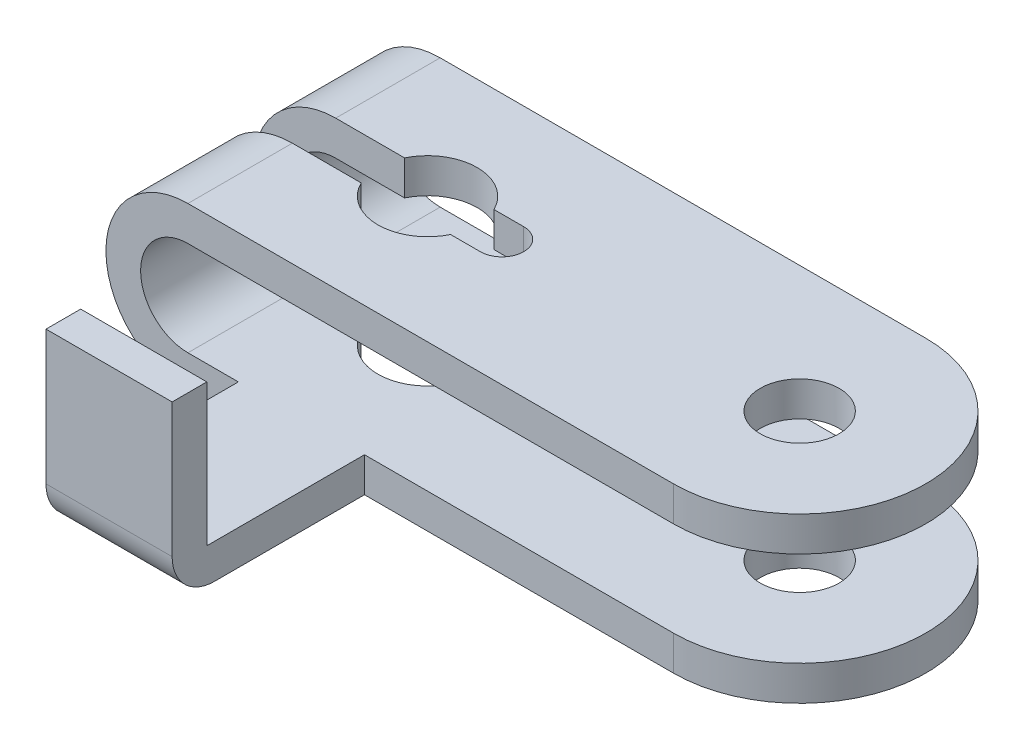
from build123d import *

# Parameters (mm, degrees)
SALIENTE_EXTRUIR1_DEPTH = 16
CORTAR_EXTRUIR1_REACH   = 45.239
CROQUIS2_W              = 5.2
CROQUIS2_H              = 2.75
CROQUIS2_R              = 2.5
CROQUIS5_W              = 4
CROQUIS5_H              = 2.2
SALIENTE_EXTRUIR4_DEPTH = 12.2
CROQUIS6_W              = 8
CROQUIS6_H              = 2.2
SALIENTE_EXTRUIR5_DEPTH = 9
REDONDEO2_R             = 2.7


with BuildPart() as part:
    # Croquis1 → Saliente-Extruir1 (new body)
    with BuildSketch(Plane.XY):
        with BuildLine():
            Line((0, -8.2), (38.8, -8.2))
            Line((38.8, -8.2), (38.8, -10.4))
            Line((38.8, -10.4), (0, -10.4))
            ThreePointArc((0, -10.4), (-5.2, -5.2), (0, 0))
            Line((0, 0), (38.8, 0))
            Line((38.8, 0), (38.8, -2.2))
            Line((38.8, -2.2), (0, -2.2))
            ThreePointArc((0, -2.2), (-3, -5.2), (0, -8.2))
        make_face()
    extrude(amount=SALIENTE_EXTRUIR1_DEPTH)

    # Cortar-Extruir1: up to this face of the body (flat: up to its plane)
    cortar_extruir1_end = Plane(part.part.faces().sort_by_distance((19.4, -10.4, 8))[0])
    # Croquis2 → Cortar-Extruir1 (cut, up to the picked face)
    with BuildSketch(Plane(origin=(0, 0, 0), x_dir=(1, 0, 0), z_dir=(0, 1, 0)), mode=Mode.PRIVATE) as cortar_extruir1_sk1:
        with Locations((-2.6, -8)):
            Rectangle(CROQUIS2_W, CROQUIS2_H)
    cortar_extruir1_tool1 = split(extrude(cortar_extruir1_sk1.sketch, amount=-CORTAR_EXTRUIR1_REACH, mode=Mode.PRIVATE), bisect_by=cortar_extruir1_end, keep=Keep.BOTH, mode=Mode.PRIVATE)
    # Croquis2 → Cortar-Extruir1 (cut, up to the picked face)
    with BuildSketch(Plane(origin=(0, 0, 0), x_dir=(1, 0, 0), z_dir=(0, 1, 0)), mode=Mode.PRIVATE) as cortar_extruir1_sk2:
        with BuildLine():
            Line((4.36594372, -6.625), (0, -6.625))
            Line((0, -6.625), (0, -9.375))
            Line((0, -9.375), (4.36594372, -9.375))
            ThreePointArc((4.36594372, -9.375), (4.05, -8), (4.36594372, -6.625))
        make_face()
    cortar_extruir1_tool2 = split(extrude(cortar_extruir1_sk2.sketch, amount=-CORTAR_EXTRUIR1_REACH, mode=Mode.PRIVATE), bisect_by=cortar_extruir1_end, keep=Keep.BOTH, mode=Mode.PRIVATE)
    # Croquis2 → Cortar-Extruir1 (cut, up to the picked face)
    with BuildSketch(Plane(origin=(0, 0, 0), x_dir=(1, 0, 0), z_dir=(0, 1, 0)), mode=Mode.PRIVATE) as cortar_extruir1_sk3:
        with BuildLine():
            ThreePointArc((10.03405628, -6.625), (7.2, -4.85), (4.36594372, -6.625))
            Line((4.36594372, -6.625), (10.03405628, -6.625))
        make_face()
    cortar_extruir1_tool3 = split(extrude(cortar_extruir1_sk3.sketch, amount=-CORTAR_EXTRUIR1_REACH, mode=Mode.PRIVATE), bisect_by=cortar_extruir1_end, keep=Keep.BOTH, mode=Mode.PRIVATE)
    # Croquis2 → Cortar-Extruir1 (cut, up to the picked face)
    with BuildSketch(Plane(origin=(0, 0, 0), x_dir=(1, 0, 0), z_dir=(0, 1, 0)), mode=Mode.PRIVATE) as cortar_extruir1_sk4:
        with BuildLine():
            Line((10.03405628, -6.625), (4.36594372, -6.625))
            ThreePointArc((4.36594372, -6.625), (4.05, -8), (4.36594372, -9.375))
            Line((4.36594372, -9.375), (10.03405628, -9.375))
            ThreePointArc((10.03405628, -9.375), (10.26999815, -8.705415735), (10.35, -8))
            ThreePointArc((10.35, -8), (10.26999815, -7.294584265), (10.03405628, -6.625))
        make_face()
    cortar_extruir1_tool4 = split(extrude(cortar_extruir1_sk4.sketch, amount=-CORTAR_EXTRUIR1_REACH, mode=Mode.PRIVATE), bisect_by=cortar_extruir1_end, keep=Keep.BOTH, mode=Mode.PRIVATE)
    # Croquis2 → Cortar-Extruir1 (cut, up to the picked face)
    with BuildSketch(Plane(origin=(0, 0, 0), x_dir=(1, 0, 0), z_dir=(0, 1, 0)), mode=Mode.PRIVATE) as cortar_extruir1_sk5:
        with BuildLine():
            Line((10.03405628, -9.375), (4.36594372, -9.375))
            ThreePointArc((4.36594372, -9.375), (7.2, -11.15), (10.03405628, -9.375))
        make_face()
    cortar_extruir1_tool5 = split(extrude(cortar_extruir1_sk5.sketch, amount=-CORTAR_EXTRUIR1_REACH, mode=Mode.PRIVATE), bisect_by=cortar_extruir1_end, keep=Keep.BOTH, mode=Mode.PRIVATE)
    # Croquis2 → Cortar-Extruir1 (cut, up to the picked face)
    with BuildSketch(Plane(origin=(0, 0, 0), x_dir=(1, 0, 0), z_dir=(0, 1, 0)), mode=Mode.PRIVATE) as cortar_extruir1_sk6:
        with BuildLine():
            Line((11.925, -6.625), (10.03405628, -6.625))
            ThreePointArc((10.03405628, -6.625), (10.26999815, -7.294584265), (10.35, -8))
            ThreePointArc((10.35, -8), (10.26999815, -8.705415735), (10.03405628, -9.375))
            Line((10.03405628, -9.375), (11.925, -9.375))
            ThreePointArc((11.925, -9.375), (13.3, -8), (11.925, -6.625))
        make_face()
    cortar_extruir1_tool6 = split(extrude(cortar_extruir1_sk6.sketch, amount=-CORTAR_EXTRUIR1_REACH, mode=Mode.PRIVATE), bisect_by=cortar_extruir1_end, keep=Keep.BOTH, mode=Mode.PRIVATE)
    # Croquis2 → Cortar-Extruir1 (cut, up to the picked face)
    with BuildSketch(Plane(origin=(0, 0, 0), x_dir=(1, 0, 0), z_dir=(0, 1, 0)), mode=Mode.PRIVATE) as cortar_extruir1_sk7:
        with Locations(Location((30.8, -8, 0), (0, 0, 180))):
            Circle(CROQUIS2_R)
    cortar_extruir1_tool7 = split(extrude(cortar_extruir1_sk7.sketch, amount=-CORTAR_EXTRUIR1_REACH, mode=Mode.PRIVATE), bisect_by=cortar_extruir1_end, keep=Keep.BOTH, mode=Mode.PRIVATE)
    # Croquis2 → Cortar-Extruir1 (cut, up to the picked face)
    with BuildSketch(Plane(origin=(0, 0, 0), x_dir=(1, 0, 0), z_dir=(0, 1, 0)), mode=Mode.PRIVATE) as cortar_extruir1_sk8:
        with BuildLine():
            Line((38.8, 0), (30.8, 0))
            ThreePointArc((30.8, 0), (36.456854249, -2.343145751), (38.8, -8))
            Line((38.8, -8), (38.8, 0))
        make_face()
    cortar_extruir1_tool8 = split(extrude(cortar_extruir1_sk8.sketch, amount=-CORTAR_EXTRUIR1_REACH, mode=Mode.PRIVATE), bisect_by=cortar_extruir1_end, keep=Keep.BOTH, mode=Mode.PRIVATE)
    # Croquis2 → Cortar-Extruir1 (cut, up to the picked face)
    with BuildSketch(Plane(origin=(0, 0, 0), x_dir=(1, 0, 0), z_dir=(0, 1, 0)), mode=Mode.PRIVATE) as cortar_extruir1_sk9:
        with BuildLine():
            Line((38.8, -16), (38.8, -8))
            ThreePointArc((38.8, -8), (36.456854249, -13.656854249), (30.8, -16))
            Line((30.8, -16), (38.8, -16))
        make_face()
    cortar_extruir1_tool9 = split(extrude(cortar_extruir1_sk9.sketch, amount=-CORTAR_EXTRUIR1_REACH, mode=Mode.PRIVATE), bisect_by=cortar_extruir1_end, keep=Keep.BOTH, mode=Mode.PRIVATE)
    add(cortar_extruir1_tool1.solids().sort_by(Axis((-2.6, 0, 8), (0, -1, 0)))[0], mode=Mode.SUBTRACT)
    add(cortar_extruir1_tool2.solids().sort_by(Axis((2.077605, 0, 8), (0, -1, 0)))[0], mode=Mode.SUBTRACT)
    add(cortar_extruir1_tool3.solids().sort_by(Axis((7.2, 0, 5.894461), (0, -1, 0)))[0], mode=Mode.SUBTRACT)
    add(cortar_extruir1_tool4.solids().sort_by(Axis((7.2, 0, 8), (0, -1, 0)))[0], mode=Mode.SUBTRACT)
    add(cortar_extruir1_tool5.solids().sort_by(Axis((7.2, 0, 10.105539), (0, -1, 0)))[0], mode=Mode.SUBTRACT)
    add(cortar_extruir1_tool6.solids().sort_by(Axis((11.641399, 0, 8), (0, -1, 0)))[0], mode=Mode.SUBTRACT)
    add(cortar_extruir1_tool7.solids().sort_by(Axis((30.8, 0, 8), (0, -1, 0)))[0], mode=Mode.SUBTRACT)
    add(cortar_extruir1_tool8.solids().sort_by(Axis((37.013056, 0, 1.786944), (0, -1, 0)))[0], mode=Mode.SUBTRACT)
    add(cortar_extruir1_tool9.solids().sort_by(Axis((37.013056, 0, 14.213056), (0, -1, 0)))[0], mode=Mode.SUBTRACT)

    # Croquis5 → Saliente-Extruir4 (add)
    with BuildSketch(Plane.XY.offset(16)):
        with Locations((5.2, -9.3)):
            Rectangle(CROQUIS5_W, CROQUIS5_H)
        with Locations((9.2, -9.3)):
            Rectangle(CROQUIS5_W, CROQUIS5_H)
    extrude(amount=SALIENTE_EXTRUIR4_DEPTH)

    # Croquis6 → Saliente-Extruir5 (add)
    with BuildSketch(Plane(origin=(0, -8.2, 0), x_dir=(1, 0, 0), z_dir=(0, 1, 0))):
        with Locations((7.2, -27.1)):
            Rectangle(CROQUIS6_W, CROQUIS6_H)
    extrude(amount=SALIENTE_EXTRUIR5_DEPTH)

    # Redondeo2
    redondeo2_edges = [part.edges().sort_by_distance(p)[0] for p in [
        (7.2, -10.4, 28.2),
    ]]
    fillet(redondeo2_edges, radius=REDONDEO2_R)


solid = part.part
